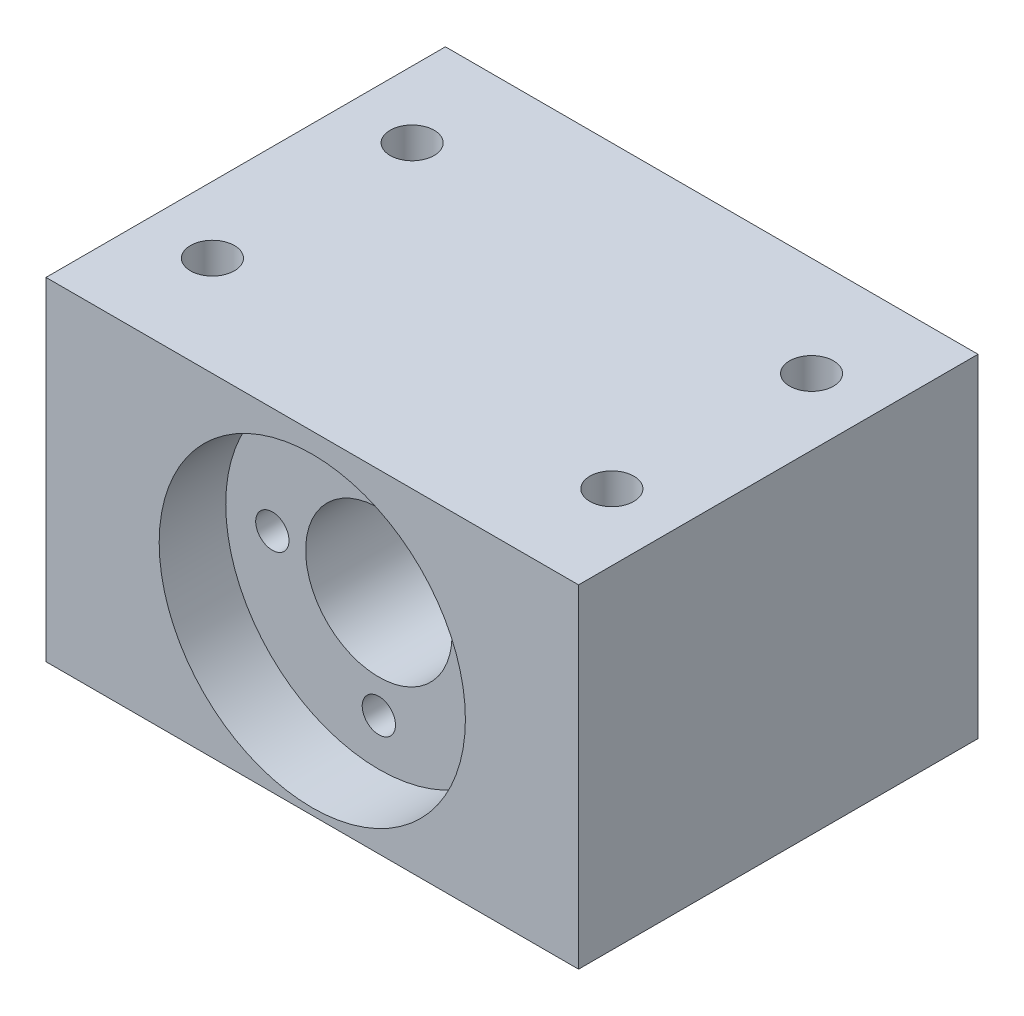
from build123d import *

# Parameters (mm, degrees)
SKETCH1_W           = 40
SKETCH1_H           = 26
BOSS_EXTRUDE1_DEPTH = 15
SKETCH2_R           = 11.5
CUT_EXTRUDE1_DEPTH  = 5
SKETCH3_R           = 5.5
CUT_EXTRUDE2_DEPTH  = 42.243181255
M4_TAPPED_HOLE1_D   = 3.3
M3_TAPPED_HOLE2_D   = 2.5
SKETCH9_W           = 40
SKETCH9_H           = 1
CUT_EXTRUDE4_DEPTH  = 45.452221542


with BuildPart() as part:
    # Sketch1 → Boss-Extrude1 (new, symmetric)
    with BuildSketch(Plane.XY):
        with Locations((0, 13)):
            Rectangle(SKETCH1_W, SKETCH1_H)
    extrude(amount=BOSS_EXTRUDE1_DEPTH, both=True)

    # Sketch2 → Cut-Extrude1 (cut)
    with BuildSketch(Plane.XY.offset(15)):
        with Locations((0, 13)):
            Circle(SKETCH2_R)
    extrude(amount=-CUT_EXTRUDE1_DEPTH, mode=Mode.SUBTRACT)

    # Sketch3 → Cut-Extrude2 (cut, through all)
    with BuildSketch(Plane.XY.offset(10)):
        with Locations((0, 13)):
            Circle(SKETCH3_R)
    extrude(amount=-CUT_EXTRUDE2_DEPTH, mode=Mode.SUBTRACT)

    # M4 Tapped Hole1 (through all)
    with Locations(Plane(origin=(0, 26, 0), x_dir=(1, 0, 0), z_dir=(0, 1, 0))):
        with Locations((-15, 7.5), (15, 7.5), (15, -7.5), (-15, -7.5)):
            Hole(M4_TAPPED_HOLE1_D / 2)

    # M3 Tapped Hole2 (through all)
    with Locations(Plane.XY.offset(10)):
        with Locations((0, 13), (0, 21), (0, 5), (-8, 13), (8, 13)):
            Hole(M3_TAPPED_HOLE2_D / 2)

    # Sketch9 → Cut-Extrude4 (cut, through all)
    with BuildSketch(Plane.XY.offset(15)):
        with Locations((0, 0.5)):
            Rectangle(SKETCH9_W, SKETCH9_H)
    extrude(amount=-CUT_EXTRUDE4_DEPTH, mode=Mode.SUBTRACT)


solid = part.part
